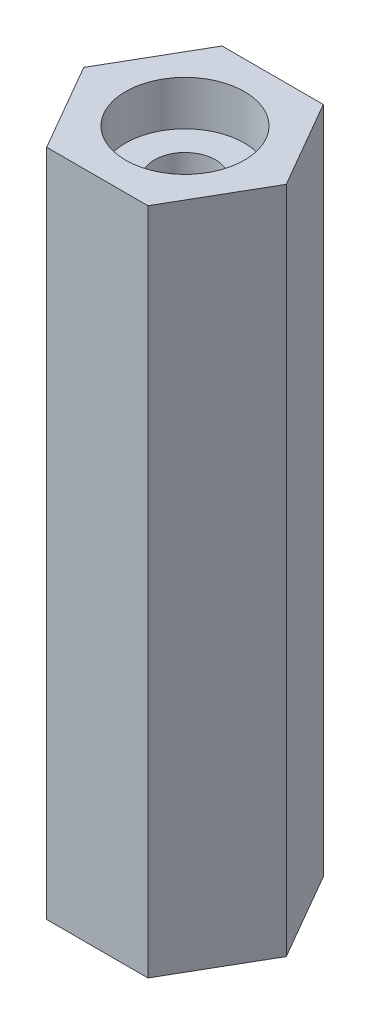
from build123d import *

# Parameters (mm, degrees)
SALIENTE_EXTRUIR1_DEPTH = 45
CROQUIS2_R              = 4
CORTAR_EXTRUIR1_DEPTH   = 3
CROQUIS3_R              = 2.05
CORTAR_EXTRUIR2_DEPTH   = 11
SALIENTE_EXTRUIR2_DEPTH = 11


with BuildPart() as part:
    # Croquis1 → Saliente-Extruir1 (new body)
    with BuildSketch(Plane(origin=(0, 0, 0), x_dir=(1, 0, 0), z_dir=(0, 1, 0))):
        Polygon((6.812733176, 0), (3.406366588, 5.9), (-3.406366588, 5.9), (-6.812733176, 0), (-3.406366588, -5.9), (3.406366588, -5.9), align=None)
    extrude(amount=SALIENTE_EXTRUIR1_DEPTH)

    # Croquis2 → Cortar-Extruir1 (cut)
    with BuildSketch(Plane(origin=(0, 45, 0), x_dir=(1, 0, 0), z_dir=(0, 1, 0))):
        with Locations(Location((0, 0, 0), (0, 0, 270))):
            Circle(CROQUIS2_R)
    extrude(amount=-CORTAR_EXTRUIR1_DEPTH, mode=Mode.SUBTRACT)

    # Croquis3 → Cortar-Extruir2 (cut)
    with BuildSketch(Plane(origin=(0, 42, 0), x_dir=(1, 0, 0), z_dir=(0, 1, 0))):
        with Locations(Location((0, 0, 0), (0, 0, 270))):
            Circle(CROQUIS3_R)
    extrude(amount=-CORTAR_EXTRUIR2_DEPTH, mode=Mode.SUBTRACT)

    # Croquis4 → Saliente-Extruir2 (add)
    with BuildSketch(Plane(origin=(0, 39.5, 0), x_dir=(1, 0, 0), z_dir=(0, 1, 0))):
        with BuildLine():
            Line((-1.449137675, 1.45), (1.449137675, 1.45))
            ThreePointArc((1.449137675, 1.45), (0, 2.05), (-1.449137675, 1.45))
        make_face()
    extrude(amount=-SALIENTE_EXTRUIR2_DEPTH)


solid = part.part
